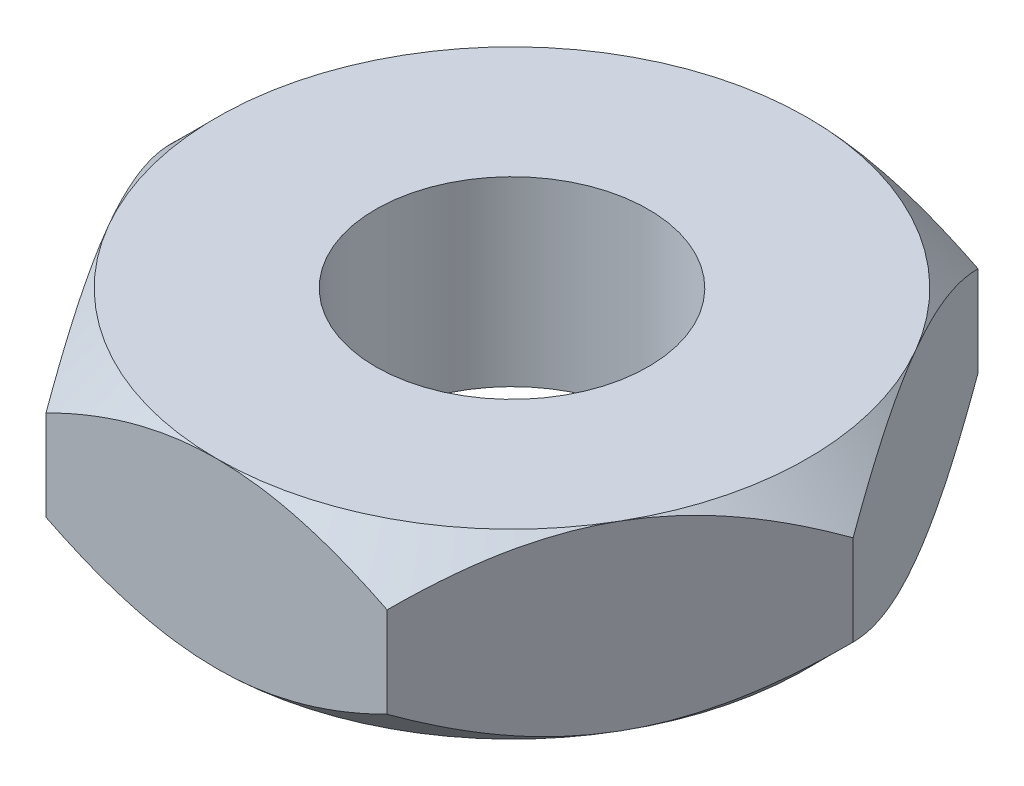
from build123d import *

# Parameters (mm, degrees)
SKETCH1_R           = 6
BOSS_EXTRUDE1_DEPTH = 8
SKETCH2_OUTSIDE_W   = 84.942
SKETCH2_OUTSIDE_H   = 80.92
SKETCH2_OUTSIDE_R   = 13
CUT_EXTRUDE1_DEPTH  = 22.408720964
CUT_EXTRUDE1_DRAFT  = -45
SKETCH5_OUTSIDE_W   = 84.942
SKETCH5_OUTSIDE_H   = 80.92
SKETCH5_OUTSIDE_R   = 13
CUT_EXTRUDE2_DEPTH  = 22.408720964
CUT_EXTRUDE2_DRAFT  = -45


with BuildPart() as part:
    # Sketch1 → Boss-Extrude1 (new body)
    with BuildSketch(Plane(origin=(0, 0, 0), x_dir=(1, 0, 0), z_dir=(0, 1, 0))):
        Polygon((-15.011106999, 0), (-7.505553499, -13), (7.505553499, -13), (15.011106999, 0), (7.505553499, 13), (-7.505553499, 13), align=None)
        with Locations(Location((0, 0, 0), (0, 0, 270))):
            Circle(SKETCH1_R, mode=Mode.SUBTRACT)
    extrude(amount=BOSS_EXTRUDE1_DEPTH)


with BuildPart() as cut_extrude1_tool:
    # Sketch2 outside → Cut-Extrude1 (with draft: the straight prism first)
    with BuildSketch(Plane(origin=(0, 8, 0), x_dir=(1, 0, 0), z_dir=(0, 1, 0))):
        Rectangle(SKETCH2_OUTSIDE_W, SKETCH2_OUTSIDE_H)
        Circle(SKETCH2_OUTSIDE_R, mode=Mode.SUBTRACT)
    extrude(amount=-CUT_EXTRUDE1_DEPTH)
    # Cut-Extrude1: the draft: its side faces are tilted about the plane it starts from
    cut_extrude1_sides = [cut_extrude1_tool.faces().sort_by_distance(p)[0] for p in [
        (0, -3.204360482, 40.46),
        (42.471, -3.204360482, 0),
        (0, -3.204360482, -40.46),
        (-42.471, -3.204360482, 0),
        (-13, -3.204360482, 0),
    ]]
    draft(cut_extrude1_sides, Plane(origin=(0, 8, 0), x_dir=(1, 0, 0), z_dir=(0, 1, 0)), CUT_EXTRUDE1_DRAFT)


with BuildPart() as part_1:
    add(part.part)

    # Cut-Extrude1: cut by cut_extrude1_tool
    add(cut_extrude1_tool.part, mode=Mode.SUBTRACT)


with BuildPart() as cut_extrude2_tool:
    # Sketch5 outside → Cut-Extrude2 (with draft: the straight prism first)
    with BuildSketch(Plane(origin=(0, 0, 0), x_dir=(-1, 0, 0), z_dir=(0, -1, 0))):
        Rectangle(SKETCH5_OUTSIDE_W, SKETCH5_OUTSIDE_H)
        Circle(SKETCH5_OUTSIDE_R, mode=Mode.SUBTRACT)
    extrude(amount=-CUT_EXTRUDE2_DEPTH)
    # Cut-Extrude2: the draft: its side faces are tilted about the plane it starts from
    cut_extrude2_sides = [cut_extrude2_tool.faces().sort_by_distance(p)[0] for p in [
        (0, 11.204360482, 40.46),
        (-42.471, 11.204360482, 0),
        (0, 11.204360482, -40.46),
        (42.471, 11.204360482, 0),
        (13, 11.204360482, 0),
    ]]
    draft(cut_extrude2_sides, Plane(origin=(0, 0, 0), x_dir=(-1, 0, 0), z_dir=(0, -1, 0)), CUT_EXTRUDE2_DRAFT)


with BuildPart() as part_2:
    add(part_1.part)

    # Cut-Extrude2: cut by cut_extrude2_tool
    add(cut_extrude2_tool.part, mode=Mode.SUBTRACT)


solid = part_2.part
